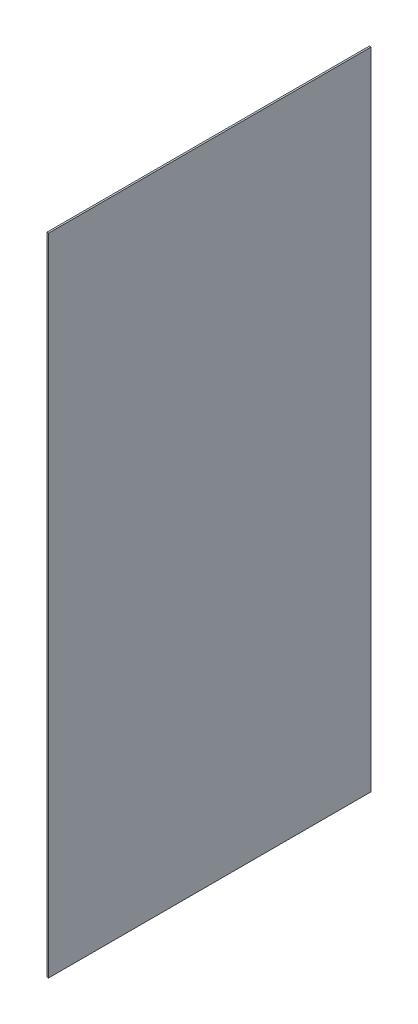
from build123d import *

# Parameters (mm, degrees)
SKETCH1_W           = 609.6
SKETCH1_H           = 1219.2
BOSS_EXTRUDE1_DEPTH = 3.175


with BuildPart() as part:
    # Sketch1 → Boss-Extrude1 (new body)
    with BuildSketch(Plane(origin=(0, 0, 0), x_dir=(0, 0, -1), z_dir=(1, 0, 0))):
        Rectangle(SKETCH1_W, SKETCH1_H)
    extrude(amount=BOSS_EXTRUDE1_DEPTH)


solid = part.part
